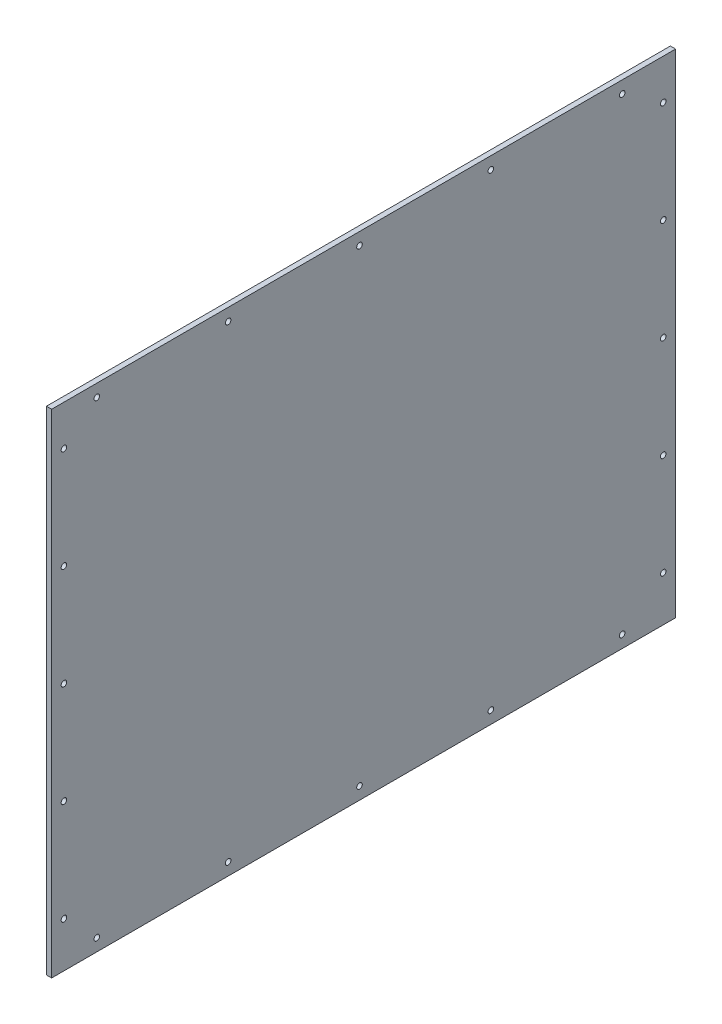
from build123d import *

# Parameters (mm, degrees)
SKETCH1_W         = 380
SKETCH1_H         = 300
PLATE_DEPTH       = 3.175
RAIL_MOUNTS_REACH = 456.112
SKETCH2_R         = 1.7


with BuildPart() as part:
    # Sketch1 → Plate (new body)
    with BuildSketch(Plane(origin=(244.693827342, 0, 0), x_dir=(0, 0, -1), z_dir=(1, 0, 0))):
        with Locations((-233.699106879, 13.360031127)):
            Rectangle(SKETCH1_W, SKETCH1_H)
    extrude(amount=PLATE_DEPTH)

    # Sketch2 → Rail_Mounts (cut, up to next)
    with BuildSketch(Plane(origin=(247.868827342, 0, 0), x_dir=(0, 0, -1), z_dir=(1, 0, 0)), mode=Mode.PRIVATE) as rail_mounts_sk1:
        with Locations((-396.199106879, 155.860031127)):
            Circle(SKETCH2_R)
    rail_mounts_tool1 = extrude(rail_mounts_sk1.sketch, amount=-RAIL_MOUNTS_REACH, mode=Mode.PRIVATE) & part.part
    # Sketch2 → Rail_Mounts (cut, up to next)
    with BuildSketch(Plane(origin=(247.868827342, 0, 0), x_dir=(0, 0, -1), z_dir=(1, 0, 0)), mode=Mode.PRIVATE) as rail_mounts_sk2:
        with Locations((-396.199106879, -129.139968873)):
            Circle(SKETCH2_R)
    rail_mounts_tool2 = extrude(rail_mounts_sk2.sketch, amount=-RAIL_MOUNTS_REACH, mode=Mode.PRIVATE) & part.part
    # Sketch2 → Rail_Mounts (cut, up to next)
    with BuildSketch(Plane(origin=(247.868827342, 0, 0), x_dir=(0, 0, -1), z_dir=(1, 0, 0)), mode=Mode.PRIVATE) as rail_mounts_sk3:
        with Locations((-316.199106879, 155.860031127)):
            Circle(SKETCH2_R)
    rail_mounts_tool3 = extrude(rail_mounts_sk3.sketch, amount=-RAIL_MOUNTS_REACH, mode=Mode.PRIVATE) & part.part
    # Sketch2 → Rail_Mounts (cut, up to next)
    with BuildSketch(Plane(origin=(247.868827342, 0, 0), x_dir=(0, 0, -1), z_dir=(1, 0, 0)), mode=Mode.PRIVATE) as rail_mounts_sk4:
        with Locations((-316.199106879, -129.139968873)):
            Circle(SKETCH2_R)
    rail_mounts_tool4 = extrude(rail_mounts_sk4.sketch, amount=-RAIL_MOUNTS_REACH, mode=Mode.PRIVATE) & part.part
    # Sketch2 → Rail_Mounts (cut, up to next)
    with BuildSketch(Plane(origin=(247.868827342, 0, 0), x_dir=(0, 0, -1), z_dir=(1, 0, 0)), mode=Mode.PRIVATE) as rail_mounts_sk5:
        with Locations((-236.199106879, 155.860031127)):
            Circle(SKETCH2_R)
    rail_mounts_tool5 = extrude(rail_mounts_sk5.sketch, amount=-RAIL_MOUNTS_REACH, mode=Mode.PRIVATE) & part.part
    # Sketch2 → Rail_Mounts (cut, up to next)
    with BuildSketch(Plane(origin=(247.868827342, 0, 0), x_dir=(0, 0, -1), z_dir=(1, 0, 0)), mode=Mode.PRIVATE) as rail_mounts_sk6:
        with Locations((-236.199106879, -129.139968873)):
            Circle(SKETCH2_R)
    rail_mounts_tool6 = extrude(rail_mounts_sk6.sketch, amount=-RAIL_MOUNTS_REACH, mode=Mode.PRIVATE) & part.part
    # Sketch2 → Rail_Mounts (cut, up to next)
    with BuildSketch(Plane(origin=(247.868827342, 0, 0), x_dir=(0, 0, -1), z_dir=(1, 0, 0)), mode=Mode.PRIVATE) as rail_mounts_sk7:
        with Locations((-156.199106879, 155.860031127)):
            Circle(SKETCH2_R)
    rail_mounts_tool7 = extrude(rail_mounts_sk7.sketch, amount=-RAIL_MOUNTS_REACH, mode=Mode.PRIVATE) & part.part
    # Sketch2 → Rail_Mounts (cut, up to next)
    with BuildSketch(Plane(origin=(247.868827342, 0, 0), x_dir=(0, 0, -1), z_dir=(1, 0, 0)), mode=Mode.PRIVATE) as rail_mounts_sk8:
        with Locations((-156.199106879, -129.139968873)):
            Circle(SKETCH2_R)
    rail_mounts_tool8 = extrude(rail_mounts_sk8.sketch, amount=-RAIL_MOUNTS_REACH, mode=Mode.PRIVATE) & part.part
    # Sketch2 → Rail_Mounts (cut, up to next)
    with BuildSketch(Plane(origin=(247.868827342, 0, 0), x_dir=(0, 0, -1), z_dir=(1, 0, 0)), mode=Mode.PRIVATE) as rail_mounts_sk9:
        with Locations((-76.199106879, 155.860031127)):
            Circle(SKETCH2_R)
    rail_mounts_tool9 = extrude(rail_mounts_sk9.sketch, amount=-RAIL_MOUNTS_REACH, mode=Mode.PRIVATE) & part.part
    # Sketch2 → Rail_Mounts (cut, up to next)
    with BuildSketch(Plane(origin=(247.868827342, 0, 0), x_dir=(0, 0, -1), z_dir=(1, 0, 0)), mode=Mode.PRIVATE) as rail_mounts_sk10:
        with Locations((-76.199106879, -129.139968873)):
            Circle(SKETCH2_R)
    rail_mounts_tool10 = extrude(rail_mounts_sk10.sketch, amount=-RAIL_MOUNTS_REACH, mode=Mode.PRIVATE) & part.part
    # Sketch2 → Rail_Mounts (cut, up to next)
    with BuildSketch(Plane(origin=(247.868827342, 0, 0), x_dir=(0, 0, -1), z_dir=(1, 0, 0)), mode=Mode.PRIVATE) as rail_mounts_sk11:
        with Locations((-416.199106879, -109.139968873)):
            Circle(SKETCH2_R)
    rail_mounts_tool11 = extrude(rail_mounts_sk11.sketch, amount=-RAIL_MOUNTS_REACH, mode=Mode.PRIVATE) & part.part
    # Sketch2 → Rail_Mounts (cut, up to next)
    with BuildSketch(Plane(origin=(247.868827342, 0, 0), x_dir=(0, 0, -1), z_dir=(1, 0, 0)), mode=Mode.PRIVATE) as rail_mounts_sk12:
        with Locations((-51.199106879, -109.139968873)):
            Circle(SKETCH2_R)
    rail_mounts_tool12 = extrude(rail_mounts_sk12.sketch, amount=-RAIL_MOUNTS_REACH, mode=Mode.PRIVATE) & part.part
    # Sketch2 → Rail_Mounts (cut, up to next)
    with BuildSketch(Plane(origin=(247.868827342, 0, 0), x_dir=(0, 0, -1), z_dir=(1, 0, 0)), mode=Mode.PRIVATE) as rail_mounts_sk13:
        with Locations((-51.199106879, -47.139968873)):
            Circle(SKETCH2_R)
    rail_mounts_tool13 = extrude(rail_mounts_sk13.sketch, amount=-RAIL_MOUNTS_REACH, mode=Mode.PRIVATE) & part.part
    # Sketch2 → Rail_Mounts (cut, up to next)
    with BuildSketch(Plane(origin=(247.868827342, 0, 0), x_dir=(0, 0, -1), z_dir=(1, 0, 0)), mode=Mode.PRIVATE) as rail_mounts_sk14:
        with Locations((-416.199106879, -47.139968873)):
            Circle(SKETCH2_R)
    rail_mounts_tool14 = extrude(rail_mounts_sk14.sketch, amount=-RAIL_MOUNTS_REACH, mode=Mode.PRIVATE) & part.part
    # Sketch2 → Rail_Mounts (cut, up to next)
    with BuildSketch(Plane(origin=(247.868827342, 0, 0), x_dir=(0, 0, -1), z_dir=(1, 0, 0)), mode=Mode.PRIVATE) as rail_mounts_sk15:
        with Locations((-51.199106879, 14.860031127)):
            Circle(SKETCH2_R)
    rail_mounts_tool15 = extrude(rail_mounts_sk15.sketch, amount=-RAIL_MOUNTS_REACH, mode=Mode.PRIVATE) & part.part
    # Sketch2 → Rail_Mounts (cut, up to next)
    with BuildSketch(Plane(origin=(247.868827342, 0, 0), x_dir=(0, 0, -1), z_dir=(1, 0, 0)), mode=Mode.PRIVATE) as rail_mounts_sk16:
        with Locations((-416.199106879, 14.860031127)):
            Circle(SKETCH2_R)
    rail_mounts_tool16 = extrude(rail_mounts_sk16.sketch, amount=-RAIL_MOUNTS_REACH, mode=Mode.PRIVATE) & part.part
    # Sketch2 → Rail_Mounts (cut, up to next)
    with BuildSketch(Plane(origin=(247.868827342, 0, 0), x_dir=(0, 0, -1), z_dir=(1, 0, 0)), mode=Mode.PRIVATE) as rail_mounts_sk17:
        with Locations((-51.199106879, 76.860031127)):
            Circle(SKETCH2_R)
    rail_mounts_tool17 = extrude(rail_mounts_sk17.sketch, amount=-RAIL_MOUNTS_REACH, mode=Mode.PRIVATE) & part.part
    # Sketch2 → Rail_Mounts (cut, up to next)
    with BuildSketch(Plane(origin=(247.868827342, 0, 0), x_dir=(0, 0, -1), z_dir=(1, 0, 0)), mode=Mode.PRIVATE) as rail_mounts_sk18:
        with Locations((-416.199106879, 76.860031127)):
            Circle(SKETCH2_R)
    rail_mounts_tool18 = extrude(rail_mounts_sk18.sketch, amount=-RAIL_MOUNTS_REACH, mode=Mode.PRIVATE) & part.part
    # Sketch2 → Rail_Mounts (cut, up to next)
    with BuildSketch(Plane(origin=(247.868827342, 0, 0), x_dir=(0, 0, -1), z_dir=(1, 0, 0)), mode=Mode.PRIVATE) as rail_mounts_sk19:
        with Locations((-51.199106879, 138.860031127)):
            Circle(SKETCH2_R)
    rail_mounts_tool19 = extrude(rail_mounts_sk19.sketch, amount=-RAIL_MOUNTS_REACH, mode=Mode.PRIVATE) & part.part
    # Sketch2 → Rail_Mounts (cut, up to next)
    with BuildSketch(Plane(origin=(247.868827342, 0, 0), x_dir=(0, 0, -1), z_dir=(1, 0, 0)), mode=Mode.PRIVATE) as rail_mounts_sk20:
        with Locations((-416.199106879, 138.860031127)):
            Circle(SKETCH2_R)
    rail_mounts_tool20 = extrude(rail_mounts_sk20.sketch, amount=-RAIL_MOUNTS_REACH, mode=Mode.PRIVATE) & part.part
    add(rail_mounts_tool1.solids().sort_by_distance((247.868827, 155.860031, 396.199107))[0], mode=Mode.SUBTRACT)
    add(rail_mounts_tool2.solids().sort_by_distance((247.868827, -129.139969, 396.199107))[0], mode=Mode.SUBTRACT)
    add(rail_mounts_tool3.solids().sort_by_distance((247.868827, 155.860031, 316.199107))[0], mode=Mode.SUBTRACT)
    add(rail_mounts_tool4.solids().sort_by_distance((247.868827, -129.139969, 316.199107))[0], mode=Mode.SUBTRACT)
    add(rail_mounts_tool5.solids().sort_by_distance((247.868827, 155.860031, 236.199107))[0], mode=Mode.SUBTRACT)
    add(rail_mounts_tool6.solids().sort_by_distance((247.868827, -129.139969, 236.199107))[0], mode=Mode.SUBTRACT)
    add(rail_mounts_tool7.solids().sort_by_distance((247.868827, 155.860031, 156.199107))[0], mode=Mode.SUBTRACT)
    add(rail_mounts_tool8.solids().sort_by_distance((247.868827, -129.139969, 156.199107))[0], mode=Mode.SUBTRACT)
    add(rail_mounts_tool9.solids().sort_by_distance((247.868827, 155.860031, 76.199107))[0], mode=Mode.SUBTRACT)
    add(rail_mounts_tool10.solids().sort_by_distance((247.868827, -129.139969, 76.199107))[0], mode=Mode.SUBTRACT)
    add(rail_mounts_tool11.solids().sort_by_distance((247.868827, -109.139969, 416.199107))[0], mode=Mode.SUBTRACT)
    add(rail_mounts_tool12.solids().sort_by_distance((247.868827, -109.139969, 51.199107))[0], mode=Mode.SUBTRACT)
    add(rail_mounts_tool13.solids().sort_by_distance((247.868827, -47.139969, 51.199107))[0], mode=Mode.SUBTRACT)
    add(rail_mounts_tool14.solids().sort_by_distance((247.868827, -47.139969, 416.199107))[0], mode=Mode.SUBTRACT)
    add(rail_mounts_tool15.solids().sort_by_distance((247.868827, 14.860031, 51.199107))[0], mode=Mode.SUBTRACT)
    add(rail_mounts_tool16.solids().sort_by_distance((247.868827, 14.860031, 416.199107))[0], mode=Mode.SUBTRACT)
    add(rail_mounts_tool17.solids().sort_by_distance((247.868827, 76.860031, 51.199107))[0], mode=Mode.SUBTRACT)
    add(rail_mounts_tool18.solids().sort_by_distance((247.868827, 76.860031, 416.199107))[0], mode=Mode.SUBTRACT)
    add(rail_mounts_tool19.solids().sort_by_distance((247.868827, 138.860031, 51.199107))[0], mode=Mode.SUBTRACT)
    add(rail_mounts_tool20.solids().sort_by_distance((247.868827, 138.860031, 416.199107))[0], mode=Mode.SUBTRACT)


solid = part.part
